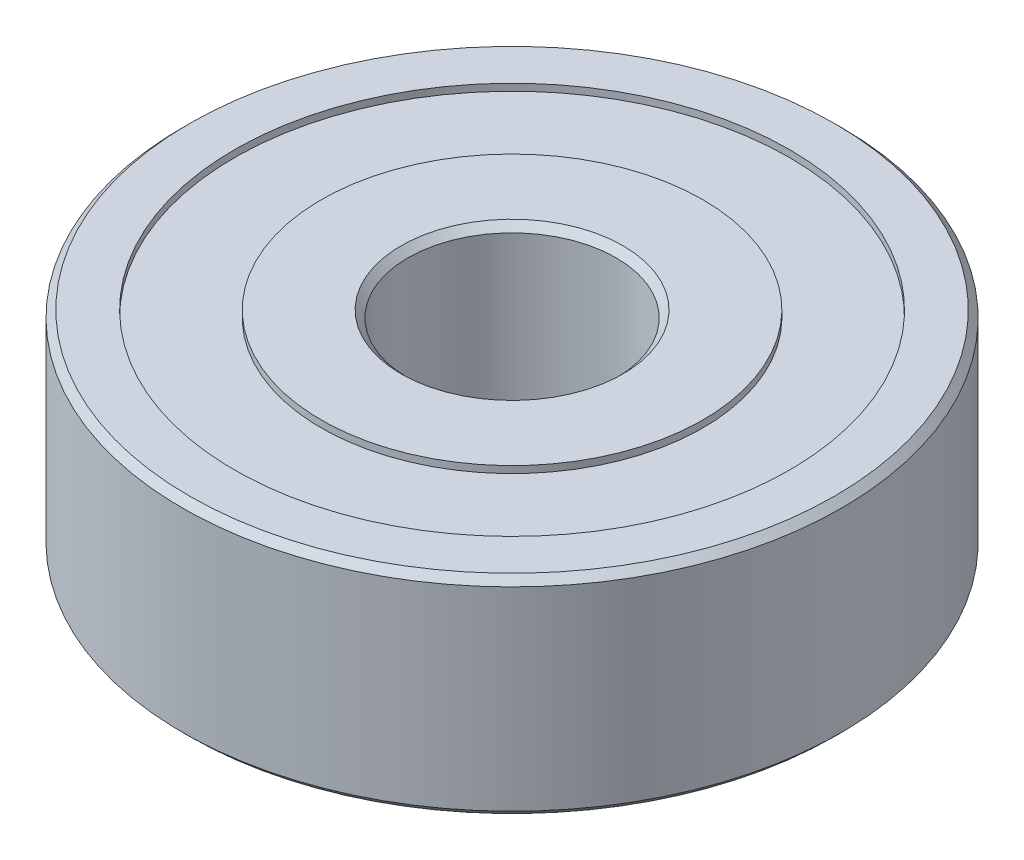
from build123d import *


with BuildPart() as part:
    # Sketch1 → Revolve1 (revolve)
    with BuildSketch(Plane.XY, mode=Mode.PRIVATE) as revolve1_sk:
        Polygon((9.5, 5.8), (9.3, 6), (8, 6), (8, 5.8), (5.5, 5.8), (5.5, 6), (3.2, 6), (3, 5.8), (3, 0.2), (3.2, 0), (5.5, 0), (5.5, 0.2), (8, 0.2), (8, 0), (9.3, 0), (9.5, 0.2), align=None)
    revolve(revolve1_sk.sketch.rotate(Axis((0, 6, 0), (0, -1, 0)), 270), axis=Axis((0, 6, 0), (0, -1, 0)))


solid = part.part
